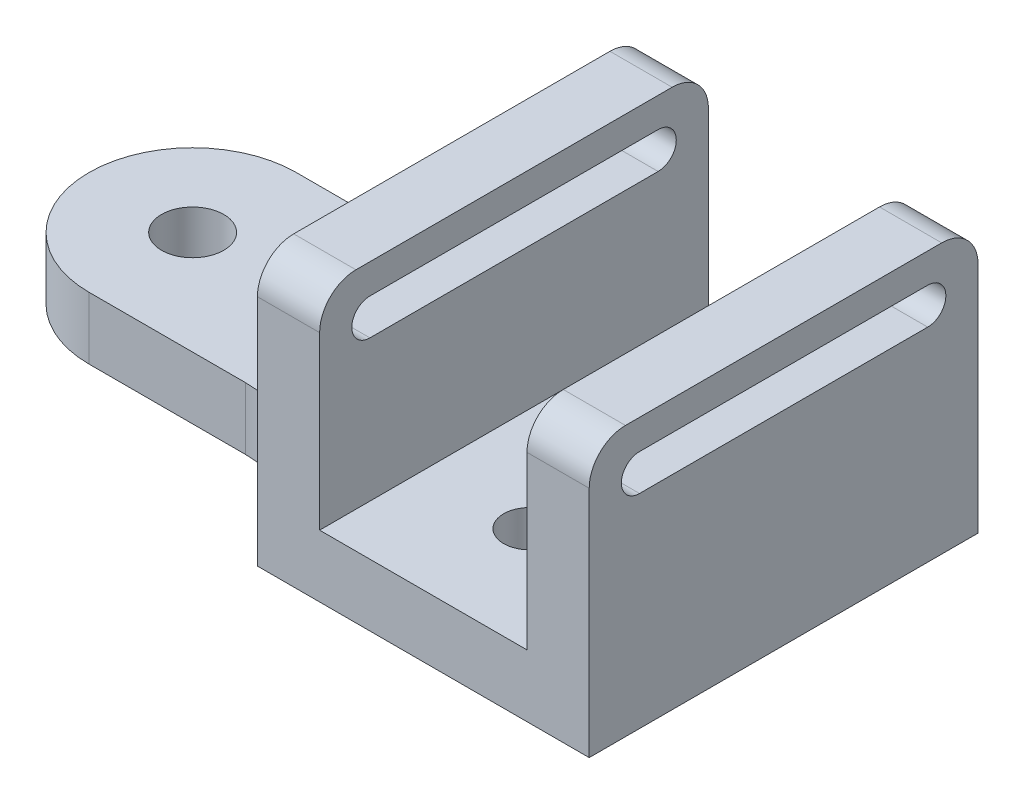
from build123d import *

# Parameters (mm, degrees)
SKETCH_1_R      = 152.4
SKETCH_1_W      = 1625.6
SKETCH_1_H      = 1905
SKETCH_1_R_2    = 127
EXTRUDE_3_DEPTH = 304.8
EXTRUDE_5_DEPTH = 304.8


with BuildPart() as part:
    # 草图1 → 凸台-拉伸3 (new body)
    # profile 1 of 2: a face of its own
    with BuildSketch(Plane(origin=(0, 0, 0), x_dir=(1, 0, 0), z_dir=(0, 1, 0))):
        with BuildLine():
            Line((-910.923193916, -584.05513308), (-144.938818674, -584.05513308))
            ThreePointArc((-144.938818674, -584.05513308), (191.071597831, -711.05513308), (359.076806084, -1028.55513308))
            Line((359.076806084, -1028.55513308), (359.076806084, 876.44486692))
            ThreePointArc((359.076806084, 876.44486692), (191.071597831, 558.94486692), (-144.938818674, 431.94486692))
            Line((-144.938818674, 431.94486692), (-910.923193916, 431.94486692))
            ThreePointArc((-910.923193916, 431.94486692), (-1418.923193916, -76.05513308), (-910.923193916, -584.05513308))
        make_face()
        with Locations(Location((-910.923193916, -76.05513308, 0), (0, 0, 90))):
            Circle(SKETCH_1_R, mode=Mode.SUBTRACT)
    # profile 2 of 2: a face of its own
    with BuildSketch(Plane(origin=(0, 0, 0), x_dir=(1, 0, 0), z_dir=(0, 1, 0))):
        with Locations((1171.876806084, -76.05513308)):
            Rectangle(SKETCH_1_W, SKETCH_1_H)
        with Locations(Location((1160.261708617, 355.74486692, 0), (0, 0, 90))):
            Circle(SKETCH_1_R_2, mode=Mode.SUBTRACT)
        with Locations(Location((1171.876806084, -507.85513308, 0), (0, 0, 90))):
            Circle(SKETCH_1_R_2, mode=Mode.SUBTRACT)
    extrude(amount=EXTRUDE_3_DEPTH)

    # 草图30 → 凸台-拉伸5 (add)
    with BuildSketch(Plane(origin=(1984.676806084, 0, 0), x_dir=(0, 0, -1), z_dir=(1, 0, 0))):
        with BuildLine():
            Line((-1028.55513308, 304.8), (876.44486692, 304.8))
            Line((876.44486692, 304.8), (876.44486692, 1143))
            ThreePointArc((876.44486692, 1143), (824.368452615, 1268.723585695), (698.64486692, 1320.8))
            Line((698.64486692, 1320.8), (-850.75513308, 1320.8))
            ThreePointArc((-850.75513308, 1320.8), (-976.478718775, 1268.723585695), (-1028.55513308, 1143))
            Line((-1028.55513308, 1143), (-1028.55513308, 304.8))
        make_face()
        with BuildLine():
            Line((-782.119591201, 1175.398916904), (630.009325042, 1175.398916904))
            ThreePointArc((630.009325042, 1175.398916904), (718.909325042, 1086.498916904), (630.009325042, 997.598916904))
            Line((630.009325042, 997.598916904), (-782.119591201, 997.598916904))
            ThreePointArc((-782.119591201, 997.598916904), (-871.019591201, 1086.498916904), (-782.119591201, 1175.398916904))
        make_face(mode=Mode.SUBTRACT)
    extrude_5 = extrude(amount=-EXTRUDE_5_DEPTH)

    # 镜向2: 凸台-拉伸5 across plane
    add(extrude_5.mirror(Plane.ZY.offset(-1171.876806084)))


solid = part.part
